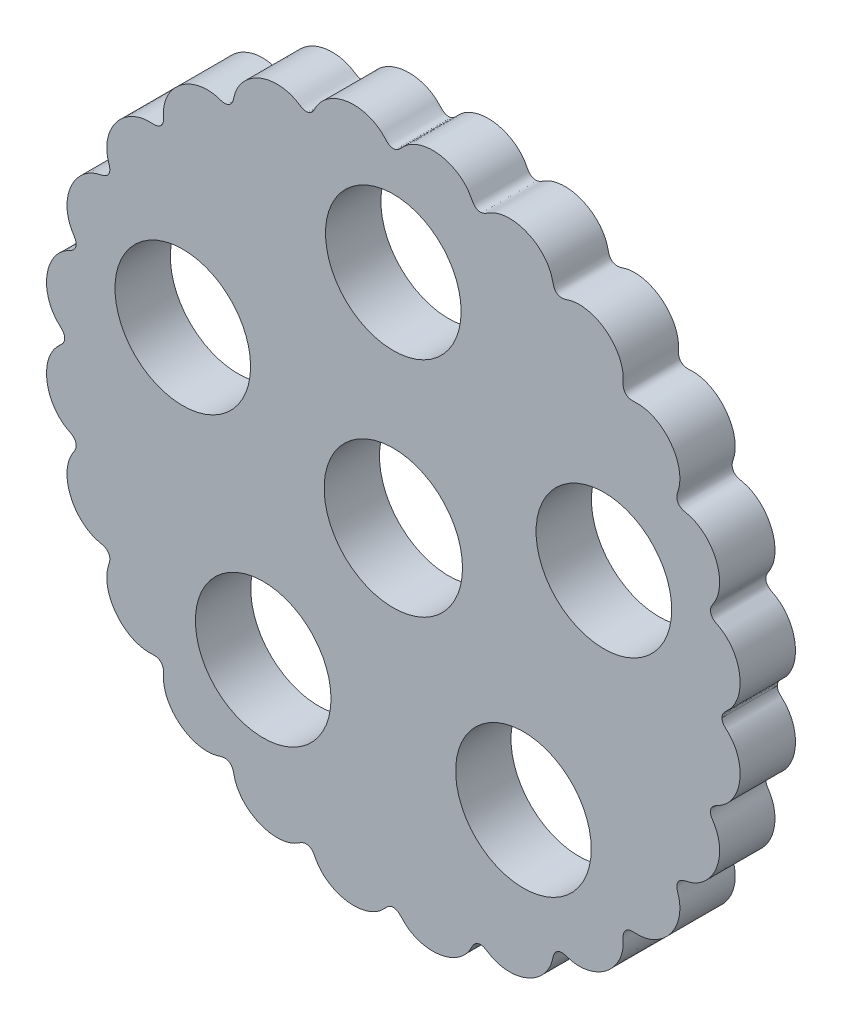
from build123d import *

# Parameters (mm, degrees)
BOSS_EXTRU_1_DEPTH      = 4
ESQUISSE2_R             = 5
ESQUISSE2_R_2           = 4.9
ENL_V_MAT_EXTRU_1_DEPTH = 36.669186724


with BuildPart() as part:
    # Esquisse1 → Boss.-Extru.1 (new body)
    with BuildSketch(Plane.XY):
        with BuildLine():
            add(Edge.make_bspline(
                [(23.75, 0), (23.75, 0.113685375), (23.821909441, 0.345296585), (24.077868999, 0.583486704), (24.326908063, 0.82199278), (24.613097625, 1.185219288), (24.880013662, 1.699987997), (25.052292539, 2.373710951), (25.0798311, 3.067999967), (24.965816076, 3.753404688), (24.714033606, 4.401107865), (24.329922533, 4.981029619), (23.904223084, 5.375759303), (23.512246653, 5.619286985), (23.197297598, 5.76581327), (22.949715111, 6.022019089), (22.891038655, 6.38200779), (23.037433824, 6.702690369), (23.295515997, 7.083595687), (23.510555882, 7.624702658), (23.606489205, 8.313253156), (23.548852645, 9.00614279), (23.349760744, 9.671786468), (23.019851169, 10.283261952), (22.570667818, 10.813939027), (22.015937939, 11.233039214), (21.481304458, 11.463444711), (21.02942286, 11.550469401), (20.699150262, 11.673684927), (20.485955339, 11.970139566), (20.480065245, 12.325488322), (20.599029023, 12.652377832), (20.704089485, 13.10163791), (20.725962851, 13.681755934), (20.587516766, 14.363396482), (20.30755438, 14.999434924), (19.90351938, 15.56471593), (19.393108738, 16.036186352), (18.794892507, 16.390752797), (18.242165415, 16.566024182), (17.782945063, 16.620462388), (17.438284021, 16.613003815), (17.08841093, 16.600844043), (16.768369356, 16.768381044), (16.600837741, 17.088408326), (16.612865409, 17.438338919), (16.620508986, 17.78290962), (16.56600564, 18.242170576), (16.390761594, 18.794880809), (16.036186226, 19.393104065), (15.564726484, 19.903512039), (14.999452311, 20.30754937), (14.363421334, 20.587508411), (13.681744414, 20.72597752), (13.101626575, 20.704051813), (12.652240196, 20.599124101), (12.325915202, 20.480042723), (11.969680287, 20.486111985), (11.673672202, 20.699151913), (11.550401968, 21.029454781), (11.463686327, 21.481264594), (11.232968039, 22.015956867), (10.813963648, 22.570667237), (10.28323891, 23.019862327), (9.671780311, 23.349763272), (9.006136858, 23.548852351), (8.31323409, 23.606494364), (7.624702202, 23.510546573), (7.083523794, 23.295550947), (6.702658517, 23.037463286), (6.381949654, 22.891053812), (6.022024229, 22.949711541), (5.765785858, 23.197325468), (5.619306078, 23.512255324), (5.375786964, 23.904233943), (4.981023481, 24.329927427), (4.401093787, 24.714039062), (3.753396021, 24.965818304), (3.067994224, 25.079831298), (2.3736948, 25.052292866), (1.699977237, 24.880007741), (1.185224014, 24.613094002), (0.821997983, 24.326886887), (0.583375818, 24.077965546), (0.344602021, 23.821926309), (7.8558e-05, 23.714039229), (-0.344221796, 23.821787286), (-0.58447714, 24.078157256), (-0.821521894, 24.326747519), (-1.185560138, 24.613219127), (-1.699910659, 24.879986409), (-2.373745176, 25.052307156), (-3.06798429, 25.07983), (-3.753392181, 24.965818486), (-4.401098458, 24.714037665), (-4.981023172, 24.329927519), (-5.375788019, 23.904233593), (-5.619305707, 23.512255448), (-5.765785861, 23.197325468), (-6.022024213, 22.949711546), (-6.38194967, 22.891053807), (-6.702658527, 23.037463282), (-7.083523782, 23.295550951), (-7.624702205, 23.510546572), (-8.313234089, 23.606494365), (-9.006136858, 23.548852351), (-9.671780311, 23.349763272), (-10.28323891, 23.019862327), (-10.813963649, 22.570667237), (-11.232968038, 22.015956867), (-11.46368633, 21.481264593), (-11.550401966, 21.029454783), (-11.673672202, 20.699151913), (-11.969680283, 20.486111987), (-12.325915234, 20.480042703), (-12.65224014, 20.599124136), (-13.101626648, 20.70405177), (-13.681744459, 20.725977476), (-14.363421661, 20.587508264), (-14.999451896, 20.307548985), (-15.564726062, 19.903513299), (-16.03618601, 19.393103949), (-16.390762107, 18.79488056), (-16.566006039, 18.24217032), (-16.62050871, 17.782909792), (-16.612865574, 17.438338818), (-16.600837716, 17.088408341), (-16.768369361, 16.76838104), (-17.088410924, 16.600844044), (-17.438284017, 16.613003827), (-17.782945049, 16.620462441), (-18.242165451, 16.566024058), (-18.794892548, 16.39075266), (-19.393108795, 16.036186162), (-19.903519262, 15.564716326), (-20.307553792, 14.999436905), (-20.587516357, 14.363397861), (-20.725962382, 13.681757514), (-20.704095637, 13.101617203), (-20.599029432, 12.652376455), (-20.480043529, 12.325561431), (-20.486003867, 11.969976192), (-20.699111524, 11.673815372), (-21.029403733, 11.55053356), (-21.481261025, 11.46359126), (-22.015948022, 11.23300426), (-22.570659914, 10.813964109), (-23.019856146, 10.283250413), (-23.349759706, 9.671788406), (-23.548851256, 9.006145556), (-23.606489445, 8.313252678), (-23.510556061, 7.62470231), (-23.295515836, 7.083596002), (-23.037433869, 6.70269028), (-22.891038653, 6.382007793), (-22.949715114, 6.022019081), (-23.197297594, 5.765813277), (-23.512246656, 5.619286981), (-23.904223081, 5.375759307), (-24.329922532, 4.98102962), (-24.714033581, 4.401107899), (-24.965816061, 3.753404709), (-25.079831012, 3.068000089), (-25.05229309, 2.373710178), (-24.880012916, 1.69998904), (-24.6131017, 1.185213578), (-24.326904048, 0.821998399), (-24.077859924, 0.583499483), (-23.821910499, 0.345294915), (-23.75, 0.113685685), (-23.75, 0)],
                knots=[0.075303121, 0.075303121, 0.075303121, 0.075303121, 0.078621066, 0.081939011, 0.085256955, 0.0885749, 0.095210789, 0.101846679, 0.108482568, 0.115118457, 0.121754346, 0.128390236, 0.135026125, 0.13834407, 0.141662014, 0.144979959, 0.148297904, 0.151615848, 0.154933793, 0.161569682, 0.168205571, 0.174841461, 0.18147735, 0.188113239, 0.194749129, 0.201385018, 0.208020907, 0.211338852, 0.214656796, 0.217974741, 0.221292686, 0.22461063, 0.227928575, 0.234564464, 0.241200354, 0.247836243, 0.254472132, 0.261108021, 0.267743911, 0.2743798, 0.277697745, 0.281015689, 0.284333634, 0.287651579, 0.290969523, 0.294287468, 0.297605412, 0.300923357, 0.307559246, 0.314195136, 0.320831025, 0.327466914, 0.334102804, 0.340738693, 0.347374582, 0.350692527, 0.354010471, 0.357328416, 0.360646361, 0.363964305, 0.36728225, 0.373918139, 0.380554029, 0.387189918, 0.393825807, 0.400461696, 0.407097586, 0.413733475, 0.420369364, 0.423687309, 0.427005254, 0.430323198, 0.433641143, 0.436959087, 0.440277032, 0.446912921, 0.453548811, 0.4601847, 0.466820589, 0.473456478, 0.480092368, 0.486728257, 0.490046202, 0.493364146, 0.496682091, 0.500000036, 0.50331798, 0.506635925, 0.50995387, 0.513271814, 0.519907703, 0.526543593, 0.533179482, 0.539815371, 0.546451261, 0.55308715, 0.559723039, 0.563040984, 0.566358928, 0.569676873, 0.572994818, 0.576312762, 0.579630707, 0.586266596, 0.592902486, 0.599538375, 0.606174264, 0.612810153, 0.619446043, 0.626081932, 0.632717821, 0.636035766, 0.639353711, 0.642671655, 0.6459896, 0.649307545, 0.652625489, 0.659261378, 0.665897268, 0.672533157, 0.679169046, 0.685804936, 0.692440825, 0.699076714, 0.702394659, 0.705712603, 0.709030548, 0.712348493, 0.715666437, 0.718984382, 0.722302327, 0.725620271, 0.732256161, 0.73889205, 0.745527939, 0.752163828, 0.758799718, 0.765435607, 0.772071496, 0.775389441, 0.778707386, 0.78202533, 0.785343275, 0.78866122, 0.791979164, 0.798615053, 0.805250943, 0.811886832, 0.818522721, 0.825158611, 0.8317945, 0.838430389, 0.845066278, 0.848384223, 0.851702168, 0.855020112, 0.858338057, 0.861656002, 0.864973946, 0.871609836, 0.878245725, 0.884881614, 0.891517503, 0.898153393, 0.904789282, 0.911425171, 0.914743116, 0.918061061, 0.921379005, 0.92469695, 0.92469695, 0.92469695, 0.92469695], degree=3))
            add(Edge.make_bspline(
                [(-23.75, 0), (-23.75, -0.113685685), (-23.821910499, -0.345294915), (-24.077859924, -0.583499483), (-24.326904048, -0.821998399), (-24.6131017, -1.185213578), (-24.880012916, -1.69998904), (-25.05229309, -2.373710178), (-25.079831012, -3.068000089), (-24.965816061, -3.753404709), (-24.714033581, -4.401107899), (-24.329922532, -4.98102962), (-23.904223081, -5.375759307), (-23.512246656, -5.619286981), (-23.197297594, -5.765813277), (-22.949715114, -6.022019081), (-22.891038653, -6.382007793), (-23.037433869, -6.70269028), (-23.295515836, -7.083596002), (-23.510556061, -7.62470231), (-23.606489445, -8.313252678), (-23.548851256, -9.006145556), (-23.349759706, -9.671788406), (-23.019856146, -10.283250413), (-22.570659914, -10.813964109), (-22.015948022, -11.23300426), (-21.481261025, -11.46359126), (-21.029403733, -11.55053356), (-20.699111524, -11.673815372), (-20.486003867, -11.969976192), (-20.480043529, -12.325561431), (-20.599029432, -12.652376455), (-20.704095637, -13.101617203), (-20.725962382, -13.681757514), (-20.587516357, -14.363397861), (-20.307553792, -14.999436905), (-19.903519262, -15.564716326), (-19.393108795, -16.036186162), (-18.794892548, -16.39075266), (-18.242165451, -16.566024058), (-17.782945049, -16.620462441), (-17.438284017, -16.613003827), (-17.088410924, -16.600844044), (-16.768369361, -16.76838104), (-16.600837716, -17.088408341), (-16.612865574, -17.438338818), (-16.62050871, -17.782909792), (-16.566006039, -18.24217032), (-16.390762107, -18.79488056), (-16.03618601, -19.393103949), (-15.564726062, -19.903513299), (-14.999451896, -20.307548985), (-14.363421661, -20.587508264), (-13.681744459, -20.725977476), (-13.101626648, -20.70405177), (-12.65224014, -20.599124136), (-12.325915234, -20.480042703), (-11.969680283, -20.486111987), (-11.673672202, -20.699151913), (-11.550401966, -21.029454783), (-11.46368633, -21.481264593), (-11.232968038, -22.015956867), (-10.813963649, -22.570667237), (-10.28323891, -23.019862327), (-9.671780311, -23.349763272), (-9.006136858, -23.548852351), (-8.313234089, -23.606494365), (-7.624702205, -23.510546572), (-7.083523782, -23.295550951), (-6.702658527, -23.037463282), (-6.38194967, -22.891053807), (-6.022024213, -22.949711546), (-5.765785861, -23.197325468), (-5.619305707, -23.512255448), (-5.375788019, -23.904233593), (-4.981023172, -24.329927519), (-4.401098458, -24.714037665), (-3.753392181, -24.965818486), (-3.06798429, -25.07983), (-2.373745176, -25.052307156), (-1.699910659, -24.879986409), (-1.185560138, -24.613219127), (-0.821521894, -24.326747519), (-0.58447714, -24.078157256), (-0.344221796, -23.821787286), (7.8558e-05, -23.714039229), (0.344602021, -23.821926309), (0.583375818, -24.077965546), (0.821997983, -24.326886887), (1.185224014, -24.613094002), (1.699977237, -24.880007741), (2.3736948, -25.052292866), (3.067994224, -25.079831298), (3.753396021, -24.965818304), (4.401093787, -24.714039062), (4.981023481, -24.329927427), (5.375786964, -23.904233943), (5.619306078, -23.512255324), (5.765785858, -23.197325468), (6.022024229, -22.949711541), (6.381949654, -22.891053812), (6.702658517, -23.037463286), (7.083523794, -23.295550947), (7.624702202, -23.510546573), (8.31323409, -23.606494364), (9.006136858, -23.548852351), (9.671780311, -23.349763272), (10.28323891, -23.019862327), (10.813963648, -22.570667237), (11.232968039, -22.015956867), (11.463686327, -21.481264594), (11.550401968, -21.029454781), (11.673672202, -20.699151913), (11.969680287, -20.486111985), (12.325915202, -20.480042723), (12.652240196, -20.599124101), (13.101626575, -20.704051813), (13.681744414, -20.72597752), (14.363421334, -20.587508411), (14.999452311, -20.30754937), (15.564726484, -19.903512039), (16.036186226, -19.393104065), (16.390761594, -18.794880809), (16.56600564, -18.242170576), (16.620508986, -17.78290962), (16.612865409, -17.438338919), (16.600837741, -17.088408326), (16.768369356, -16.768381044), (17.08841093, -16.600844043), (17.438284021, -16.613003815), (17.782945063, -16.620462388), (18.242165415, -16.566024182), (18.794892507, -16.390752797), (19.393108738, -16.036186352), (19.90351938, -15.56471593), (20.30755438, -14.999434924), (20.587516766, -14.363396482), (20.725962851, -13.681755934), (20.704089485, -13.10163791), (20.599029023, -12.652377832), (20.480065245, -12.325488322), (20.485955339, -11.970139566), (20.699150262, -11.673684927), (21.02942286, -11.550469401), (21.481304458, -11.463444711), (22.015937939, -11.233039214), (22.570667818, -10.813939027), (23.019851169, -10.283261952), (23.349760744, -9.671786468), (23.548852645, -9.00614279), (23.606489205, -8.313253156), (23.510555882, -7.624702658), (23.295515997, -7.083595686), (23.037433824, -6.702690369), (22.891038655, -6.38200779), (22.949715111, -6.022019089), (23.197297598, -5.76581327), (23.512246653, -5.619286985), (23.904223084, -5.375759303), (24.329922533, -4.981029619), (24.714033606, -4.401107865), (24.965816076, -3.753404688), (25.0798311, -3.067999967), (25.052292539, -2.373710951), (24.880013662, -1.699987997), (24.613097625, -1.185219288), (24.326908063, -0.82199278), (24.077868999, -0.583486704), (23.821909441, -0.345296585), (23.75, -0.113685375), (23.75, 0)],
                knots=[0.075303121, 0.075303121, 0.075303121, 0.075303121, 0.078621066, 0.081939011, 0.085256955, 0.0885749, 0.095210789, 0.101846679, 0.108482568, 0.115118457, 0.121754346, 0.128390236, 0.135026125, 0.13834407, 0.141662014, 0.144979959, 0.148297904, 0.151615848, 0.154933793, 0.161569682, 0.168205571, 0.174841461, 0.18147735, 0.188113239, 0.194749129, 0.201385018, 0.208020907, 0.211338852, 0.214656796, 0.217974741, 0.221292686, 0.22461063, 0.227928575, 0.234564464, 0.241200354, 0.247836243, 0.254472132, 0.261108021, 0.267743911, 0.2743798, 0.277697745, 0.281015689, 0.284333634, 0.287651579, 0.290969523, 0.294287468, 0.297605412, 0.300923357, 0.307559246, 0.314195136, 0.320831025, 0.327466914, 0.334102804, 0.340738693, 0.347374582, 0.350692527, 0.354010471, 0.357328416, 0.360646361, 0.363964305, 0.36728225, 0.373918139, 0.380554029, 0.387189918, 0.393825807, 0.400461696, 0.407097586, 0.413733475, 0.420369364, 0.423687309, 0.427005254, 0.430323198, 0.433641143, 0.436959087, 0.440277032, 0.446912921, 0.453548811, 0.4601847, 0.466820589, 0.473456478, 0.480092368, 0.486728257, 0.490046202, 0.493364146, 0.496682091, 0.500000036, 0.50331798, 0.506635925, 0.50995387, 0.513271814, 0.519907703, 0.526543593, 0.533179482, 0.539815371, 0.546451261, 0.55308715, 0.559723039, 0.563040984, 0.566358928, 0.569676873, 0.572994818, 0.576312762, 0.579630707, 0.586266596, 0.592902486, 0.599538375, 0.606174264, 0.612810153, 0.619446043, 0.626081932, 0.632717821, 0.636035766, 0.639353711, 0.642671655, 0.6459896, 0.649307545, 0.652625489, 0.659261378, 0.665897268, 0.672533157, 0.679169046, 0.685804936, 0.692440825, 0.699076714, 0.702394659, 0.705712603, 0.709030548, 0.712348493, 0.715666437, 0.718984382, 0.722302327, 0.725620271, 0.732256161, 0.73889205, 0.745527939, 0.752163828, 0.758799718, 0.765435607, 0.772071496, 0.775389441, 0.778707386, 0.78202533, 0.785343275, 0.78866122, 0.791979164, 0.798615053, 0.805250943, 0.811886832, 0.818522721, 0.825158611, 0.8317945, 0.838430389, 0.845066278, 0.848384223, 0.851702168, 0.855020112, 0.858338057, 0.861656002, 0.864973946, 0.871609836, 0.878245725, 0.884881614, 0.891517503, 0.898153393, 0.904789282, 0.911425171, 0.914743116, 0.918061061, 0.921379005, 0.92469695, 0.92469695, 0.92469695, 0.92469695], degree=3))
        make_face()
    extrude(amount=BOSS_EXTRU_1_DEPTH)

    # Esquisse2 → Enlèv. mat.-Extru.1 (cut, through all)
    with BuildSketch(Plane.XY.offset(4)):
        Circle(ESQUISSE2_R)
        with Locations((0, 16)):
            Circle(ESQUISSE2_R_2)
        with Locations((15.216904261, 4.94427191)):
            Circle(ESQUISSE2_R_2)
        with Locations((9.404564037, -12.94427191)):
            Circle(ESQUISSE2_R_2)
        with Locations((-9.404564037, -12.94427191)):
            Circle(ESQUISSE2_R_2)
        with Locations((-15.216904261, 4.94427191)):
            Circle(ESQUISSE2_R_2)
    extrude(amount=-ENL_V_MAT_EXTRU_1_DEPTH, mode=Mode.SUBTRACT)


solid = part.part
